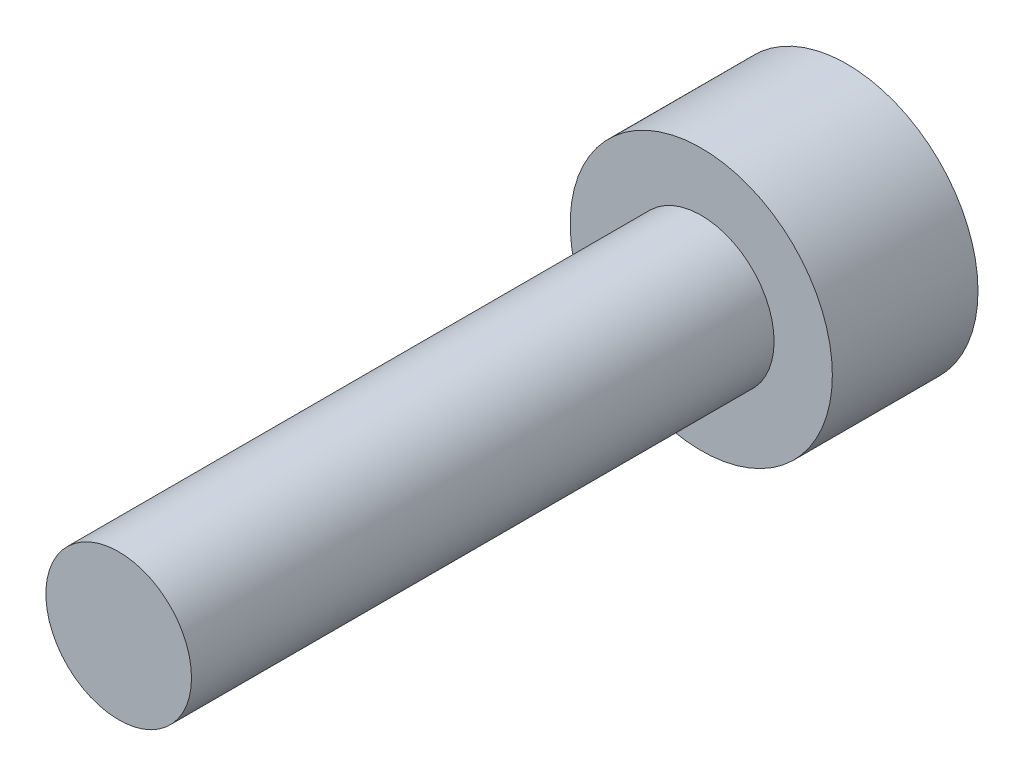
from build123d import *

# Parameters (mm, degrees)
CABEZA_START            = -2.5
SK_CABEZA_R             = 2.25
CABEZA_DEPTH            = 2.5
SK_CUERPO_R             = 1.25
CUERPO_DEPTH            = 10
HEXAGONO_INTERIOR_START = -2.5
HEXAGONO_INTERIOR_DEPTH = 1.25


with BuildPart() as part:
    # Sk_Cabeza → Cabeza (new body)
    with BuildSketch(Plane.XY.offset(CABEZA_START)):
        Circle(SK_CABEZA_R)
    extrude(amount=CABEZA_DEPTH)

    # Sk_Cuerpo → Cuerpo (add)
    with BuildSketch(Plane.XY):
        Circle(SK_CUERPO_R)
    extrude(amount=CUERPO_DEPTH)

    # Sk_Hexagono_interior → Hexagono_interior (cut)
    with BuildSketch(Plane.XY.offset(HEXAGONO_INTERIOR_START)):
        Polygon((0, -1.154700538), (1, -0.577350269), (1, 0.577350269), (0, 1.154700538), (-1, 0.577350269), (-1, -0.577350269), align=None)
    extrude(amount=HEXAGONO_INTERIOR_DEPTH, mode=Mode.SUBTRACT)


solid = part.part
